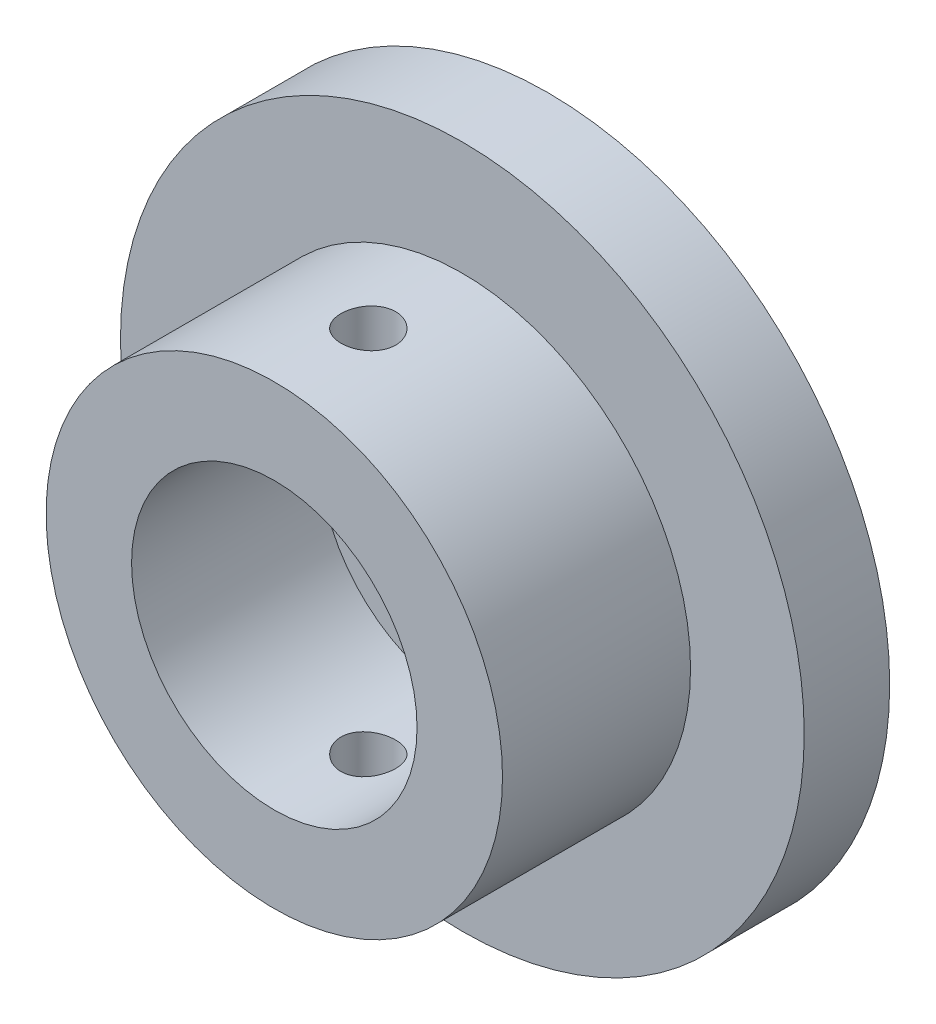
from build123d import *

# Parameters (mm, degrees)
CROQUIS1_R              = 20
SALIENTE_EXTRUIR1_DEPTH = 5
CROQUIS2_R              = 13.35
CROQUIS2_R_2            = 8.35
SALIENTE_EXTRUIR2_DEPTH = 11
CROQUIS3_R              = 1.6
CORTAR_EXTRUIR1_DEPTH   = 20
CROQUIS4_R              = 12.903487901
CORTAR_EXTRUIR3_DEPTH   = 1


with BuildPart() as part:
    # Croquis1 → Saliente-Extruir1 (new body)
    with BuildSketch(Plane.XY):
        Circle(CROQUIS1_R)
    extrude(amount=SALIENTE_EXTRUIR1_DEPTH)

    # Croquis2 → Saliente-Extruir2 (add)
    with BuildSketch(Plane.XY.offset(5)):
        Circle(CROQUIS2_R)
        Circle(CROQUIS2_R_2, mode=Mode.SUBTRACT)
    extrude(amount=SALIENTE_EXTRUIR2_DEPTH)

    # Croquis3 → Cortar-Extruir1 (cut, symmetric)
    with BuildSketch(Plane(origin=(0, 0, 0), x_dir=(1, 0, 0), z_dir=(0, 1, 0))):
        with Locations(Location((0, -10.5, 0), (0, 0, 270))):
            Circle(CROQUIS3_R)
    extrude(amount=CORTAR_EXTRUIR1_DEPTH, both=True, mode=Mode.SUBTRACT)

    # Croquis4 → Cortar-Extruir3 (cut)
    with BuildSketch(Plane(origin=(0, 0, 0), x_dir=(-1, 0, 0), z_dir=(0, 0, -1))):
        Circle(CROQUIS4_R)
    extrude(amount=-CORTAR_EXTRUIR3_DEPTH, mode=Mode.SUBTRACT)


solid = part.part
